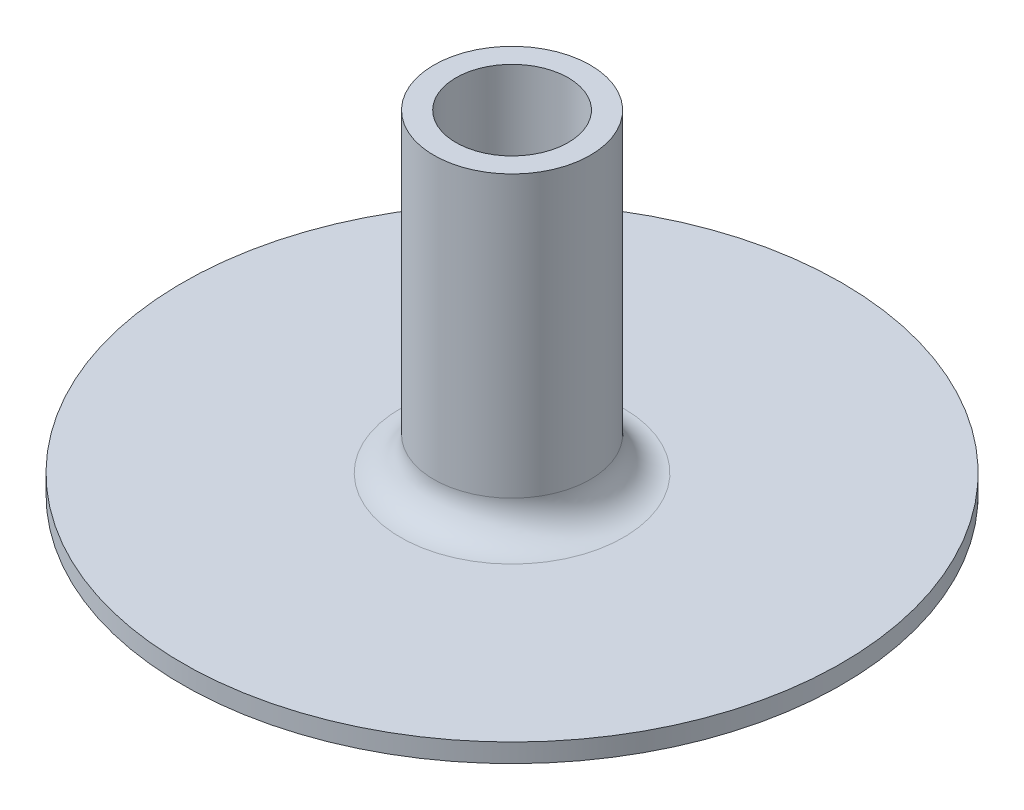
from build123d import *

# Parameters (mm, degrees)
FILLET1_R = 0.635


with BuildPart() as part:
    # Sketch1 → Revolve1 (revolve)
    with BuildSketch(Plane.XY, mode=Mode.PRIVATE) as revolve1_sk:
        Polygon((-1.0668, 0), (-1.0668, 6.3246), (-1.4859, 6.3246), (-1.4859, 0.3556), (-6.2611, 0.3556), (-6.2611, 0), align=None)
    revolve(revolve1_sk.sketch.rotate(Axis((0, 0, 0), (0, 1, 0)), 270), axis=Axis((0, 0, 0), (0, 1, 0)))

    # Fillet1
    fillet1_edges = [part.edges().sort_by_distance(p)[0] for p in [
        (0, 0.3556, 1.4859),
        (0, 0, 1.0668),
    ]]
    fillet(fillet1_edges, radius=FILLET1_R)


solid = part.part
